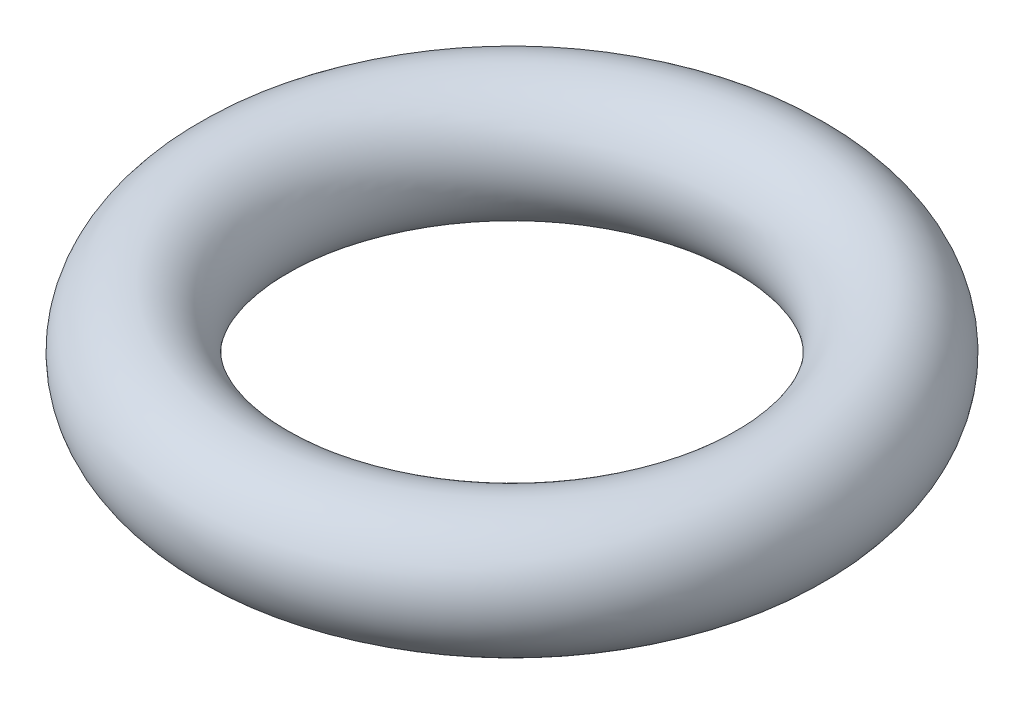
from build123d import *

# Parameters (mm, degrees)
SKETCH_1_R = 1.5


with BuildPart() as part:
    # Эскиз1 → Повернуть1 (revolve)
    with BuildSketch(Plane.XY, mode=Mode.PRIVATE) as revolve_1_sk:
        with Locations((6.5, 0)):
            Circle(SKETCH_1_R)
    revolve(revolve_1_sk.sketch.rotate(Axis((0, 0, 0), (0, 1, 0)), 90), axis=Axis((0, 0, 0), (0, 1, 0)))


solid = part.part
